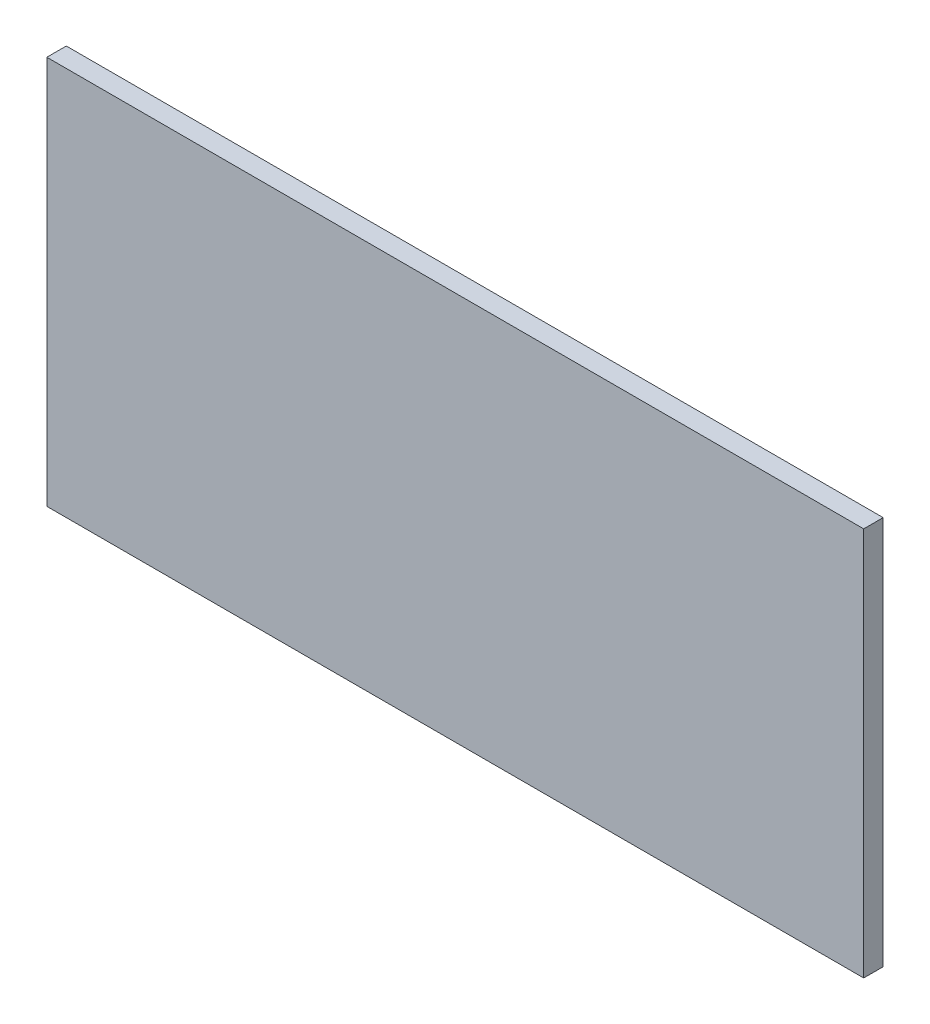
from build123d import *

# Parameters (mm, degrees)
SKETCH_1_W      = 126
SKETCH_1_H      = 60
EXTRUDE_1_DEPTH = 3


with BuildPart() as part:
    # 草图1 → 凸台-拉伸1 (new body)
    with BuildSketch(Plane.XY):
        Rectangle(SKETCH_1_W, SKETCH_1_H)
    extrude(amount=EXTRUDE_1_DEPTH)


solid = part.part
